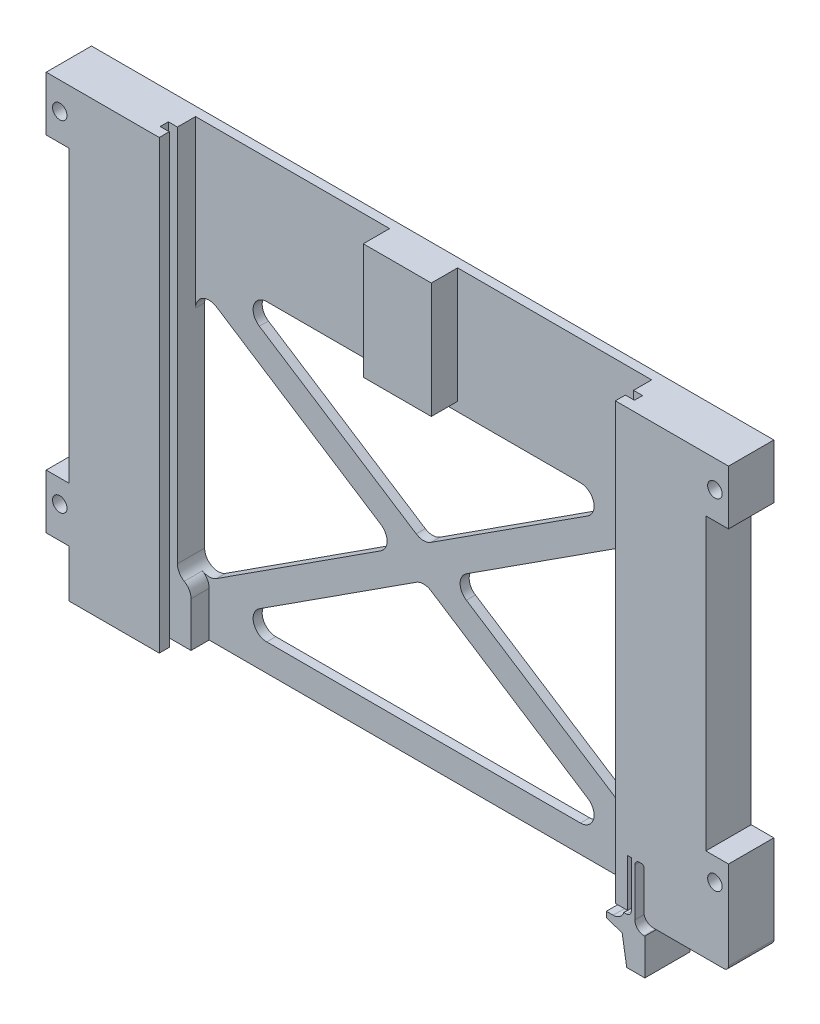
from build123d import *

# Parameters (mm, degrees)
SKETCH2_W           = 140.5
SKETCH2_H           = 98.5
BOSS_EXTRUDE6_DEPTH = 10
SKETCH10_W          = 100.6
SKETCH10_H          = 71
CUT_EXTRUDE4_DEPTH  = 172.8793181275746
CUT_EXTRUDE1_DEPTH  = 172.8793181275746
SKETCH5_W           = 100.6
SKETCH5_H           = 6
BOSS_EXTRUDE3_DEPTH = 2
CUT_EXTRUDE2_DEPTH  = 172.8793181275746
SKETCH4_4_R         = 1.5999999999999908
SKETCH4_4_R_2       = 1.599999999999993
SKETCH4_4_R_3       = 1.6000000000000039
SKETCH4_4_R_4       = 1.6000000000000003
BOSS_EXTRUDE7_DEPTH = 10
FILLET1_R           = 3
SKETCH4_3_R         = 1.5999999999999908
SKETCH4_3_R_2       = 1.599999999999993
SKETCH4_3_R_3       = 1.6000000000000039
SKETCH4_3_R_4       = 1.6000000000000003
BOSS_EXTRUDE2_DEPTH = 10
SKETCH7_W           = 100.6
SKETCH7_H           = 27.5
CUT_EXTRUDE3_DEPTH  = 8
SKETCH8_W           = 15.000000000000007
SKETCH8_H           = 25.5
BOSS_EXTRUDE4_DEPTH = 5.8
BOSS_EXTRUDE5_DEPTH = 4
FILLET2_R           = 3


with BuildPart() as part:
    # Sketch2 → Boss-Extrude6 (new body)
    with BuildSketch(Plane.XY):
        with Locations((70.25, 49.25)):
            Rectangle(SKETCH2_W, SKETCH2_H)
    extrude(amount=BOSS_EXTRUDE6_DEPTH)

    # Sketch10 → Cut-Extrude4 (cut, through all)
    with BuildSketch(Plane(origin=(0, 0, 0), x_dir=(-1, 0, 0), z_dir=(0, 0, -1))):
        with Locations((-70.25000000000001, 35.5)):
            Rectangle(SKETCH10_W, SKETCH10_H)
    extrude(amount=-CUT_EXTRUDE4_DEPTH, mode=Mode.SUBTRACT)

    # Sketch3 → Cut-Extrude1 (cut, through all)
    with BuildSketch(Plane.XZ):
        Polygon((17.950000000000006, 7.800000000000001), (122.55000000000001, 7.800000000000013), (122.55000000000001, 6.000000000000013), (17.950000000000006, 6), align=None)
    extrude(amount=-CUT_EXTRUDE1_DEPTH, mode=Mode.SUBTRACT)

    # Sketch5 → Boss-Extrude3 (add)
    with BuildSketch(Plane.XY):
        with Locations((70.25000000000001, 3)):
            Rectangle(SKETCH5_W, SKETCH5_H)
        Polygon((21.57809178761083, 3.480214864097709), (122.17809178761084, 68.48021486409772), (118.92190821238917, 73.51978513590232), (18.321908212389175, 8.519785135902309), align=None)
        Polygon((18.32190821238918, 68.48021486409769), (118.92190821238916, 3.4802148640977055), (122.17809178761082, 8.519785135902305), (21.578091787610838, 73.5197851359023), align=None)
    extrude(amount=BOSS_EXTRUDE3_DEPTH)

    # Sketch4 → Cut-Extrude2 (cut, through all)
    with BuildSketch(Plane.XY):
        with BuildLine():
            ThreePointArc((120.05000000000001, 4.44e-15), (121.50773797371134, 0.46899039884100846), (122.41854385646542, 1.6999999999999988))
            Line((122.41854385646542, 1.7000000000000002), (123.05000000000001, 1.7000000000000002))
            ThreePointArc((123.05000000000001, 1.7000000000000028), (123.75710678118656, 1.99289321881345), (124.05000000000001, 2.7))
            Line((124.05000000000001, 2.7), (124.05000000000001, 12.999999999999996))
            Line((124.05000000000001, 12.999999999999998), (123.25000000000001, 12.999999999999998))
            Line((123.25000000000001, 12.999999999999998), (123.25000000000001, 2.5))
            Line((123.25000000000001, 2.5), (117.55, 2.5))
            Line((117.55, 2.5), (117.55, 0))
            Line((117.55, 0), (118.55, 0))
            Line((118.55, 0), (120.05000000000001, 0))
        make_face()
        with BuildLine():
            ThreePointArc((144.50000000000003, 2), (145.20710678118658, 2.2928932188134525), (145.50000000000006, 3))
            Line((145.50000000000006, 3), (145.50000000000003, -0.5000000000000178))
            Line((145.50000000000003, -0.5000000000000178), (127.05, -0.5000000000000178))
            Line((127.05, -0.5000000000000178), (126.85, -0.5000000000000178))
            ThreePointArc((126.85, -0.5000000000000178), (125.4357864376269, 0.08578643762688709), (124.85, 1.499999999999982))
            Line((124.85, 1.499999999999982), (124.85, 12))
            ThreePointArc((124.85, 12), (125.14289321881344, 12.707106781186548), (125.85, 12.999999999999998))
            Line((125.85, 12.999999999999998), (126.35, 13))
            ThreePointArc((126.35, 13), (126.70355339059327, 12.853553390593271), (126.85, 12.499999999999998))
            Line((126.85, 12.499999999999998), (126.85, 4))
            ThreePointArc((126.85, 4), (127.4357864376269, 2.585786437626905), (128.85, 2))
            Line((128.85, 2), (144.50000000000003, 2))
        make_face()
    extrude(amount=CUT_EXTRUDE2_DEPTH, mode=Mode.SUBTRACT)

    # Sketch4<4> → Boss-Extrude7 (add, through all)
    # profile 1 of 4: a face of its own
    with BuildSketch(Plane.XY):
        with BuildLine():
            Line((128.85, 2), (144.50000000000003, 2))
            ThreePointArc((144.50000000000003, 2), (145.20710678118658, 2.2928932188134525), (145.50000000000006, 3))
            Line((145.50000000000006, 3), (145.50000000000003, 22.5))
            Line((145.50000000000003, 22.5), (140.5, 22.500000000000004))
            Line((140.5, 22.500000000000004), (124.05000000000001, 22.5))
            Line((124.05000000000001, 22.5), (124.05000000000001, 12.999999999999998))
            Line((124.05000000000001, 12.999999999999998), (124.05000000000001, 2.7))
            ThreePointArc((124.05000000000001, 2.7), (123.75710678118656, 1.9928932188134527), (123.05000000000001, 1.7000000000000002))
            Line((123.05000000000001, 1.7000000000000002), (122.41854385646542, 1.7000000000000002))
            ThreePointArc((122.41854385646542, 1.7000000000000002), (121.50773797371134, 0.4689903988410107), (120.05000000000001, 0))
            Line((120.05000000000001, 0), (118.55, 0))
            Line((118.55, 0), (118.55, -1.2))
            Line((118.55, -1.2), (122.05, -2.409773966310486))
            Line((122.05, -2.409773966310486), (123.05, -8.50000000000002))
            Line((123.05, -8.50000000000002), (127.05, -8.500000000000018))
            Line((127.05, -8.500000000000018), (127.05, -0.5000000000000178))
            Line((127.05, -0.5000000000000178), (126.85, -0.5000000000000178))
            ThreePointArc((126.85, -0.5000000000000178), (125.4357864376269, 0.08578643762688709), (124.85, 1.499999999999982))
            Line((124.85, 1.499999999999982), (124.85, 12))
            ThreePointArc((124.85, 12), (125.14289321881344, 12.707106781186548), (125.85, 12.999999999999998))
            Line((125.85, 12.999999999999998), (126.35, 13))
            ThreePointArc((126.35, 13), (126.70355339059327, 12.853553390593271), (126.85, 12.499999999999998))
            Line((126.85, 12.499999999999998), (126.85, 4))
            ThreePointArc((126.85, 4), (127.4357864376269, 2.585786437626905), (128.85, 2))
        make_face()
        with Locations((142.50000000000003, 17.5)):
            Circle(SKETCH4_4_R, mode=Mode.SUBTRACT)
    # profile 2 of 4: a face of its own
    with BuildSketch(Plane.XY):
        Polygon((145.50000000000003, 98.5), (145.50000000000003, 86.50000000000001), (140.5, 86.50000000000003), (140.5, 98.5), align=None)
        with Locations((142.5, 92.5)):
            Circle(SKETCH4_4_R_2, mode=Mode.SUBTRACT)
    # profile 3 of 4: a face of its own
    with BuildSketch(Plane.XY):
        Polygon((0, 98.49999999999999), (0, 86.50000000000001), (-5.000000000000004, 86.5), (-5.000000000000004, 98.49999999999999), align=None)
        with Locations((-1.9999999999999913, 92.5)):
            Circle(SKETCH4_4_R_3, mode=Mode.SUBTRACT)
    # profile 4 of 4: a face of its own
    with BuildSketch(Plane.XY):
        Polygon((8.67e-15, 22.499999999999986), (1.041e-14, 10.49999999999999), (-4.999999999999993, 10.499999999999986), (-4.999999999999996, 22.499999999999982), align=None)
        with Locations((-2.0000000000000018, 17.5)):
            Circle(SKETCH4_4_R_4, mode=Mode.SUBTRACT)
    extrude(amount=BOSS_EXTRUDE7_DEPTH)

    # Fillet1
    fillet1_edges = [part.edges().sort_by_distance(p)[0] for p in [
        (19.95000000000001, 67.42826688999527, 1),
        (19.949999999999992, 9.571733110004725, 1),
        (25.4779438594842, 71.00000000000001, 1),
        (115.02205614051576, 71, 1),
        (120.55000000000001, 9.571733110004711, 1),
        (120.55000000000003, 67.42826688999531, 1),
        (75.77794385948422, 38.50000000000003, 1),
        (70.24999999999997, 42.07173311000473, 1),
        (64.72205614051575, 38.499999999999986, 1),
        (25.477943859484185, 6.000000000000001, 1),
        (70.25, 34.928266889995285, 1),
        (115.0220561405158, 5.999999999999968, 1),
    ]]
    fillet(fillet1_edges, radius=FILLET1_R)

    # Sketch4<3> → Boss-Extrude2 (add, through all)
    # profile 1 of 4: a face of its own
    with BuildSketch(Plane.XY):
        with BuildLine():
            Line((123.05000000000001, 1.7000000000000002), (122.41854385646542, 1.7000000000000002))
            ThreePointArc((122.41854385646542, 1.6999999999999988), (121.50773797371134, 0.46899039884100846), (120.05000000000001, 4.44e-15))
            Line((120.05000000000001, 0), (118.55, 0))
            Line((118.55, 0), (118.55, -1.2))
            Line((118.55, -1.2), (122.05, -2.409773966310486))
            Line((122.05, -2.4097739663104853), (123.05, -8.50000000000002))
            Line((123.05, -8.50000000000002), (127.05, -8.500000000000018))
            Line((127.05, -8.500000000000018), (127.05, -0.5000000000000178))
            Line((127.05, -0.5000000000000178), (126.85, -0.5000000000000178))
            ThreePointArc((126.85, -0.5000000000000151), (125.4357864376269, 0.08578643762688865), (124.85, 1.499999999999982))
            Line((124.85, 1.4999999999999822), (124.85, 12))
            ThreePointArc((124.85, 12), (125.14289321881344, 12.70710678118655), (125.85, 12.999999999999996))
            Line((125.85, 12.999999999999998), (126.35, 13))
            ThreePointArc((126.35, 13), (126.70355339059327, 12.853553390593273), (126.85, 12.499999999999998))
            Line((126.85, 12.499999999999998), (126.85, 4))
            ThreePointArc((126.85, 4), (127.4357864376269, 2.585786437626907), (128.85, 2.000000000000003))
            Line((128.85, 2), (144.50000000000003, 2))
            ThreePointArc((144.50000000000003, 2.000000000000009), (145.20710678118658, 2.292893218813456), (145.50000000000006, 3))
            Line((145.50000000000006, 3), (145.50000000000003, 22.5))
            Line((145.50000000000003, 22.5), (140.5, 22.500000000000004))
            Line((140.5, 22.500000000000004), (124.05000000000001, 22.5))
            Line((124.05000000000001, 22.5), (124.05000000000001, 12.999999999999998))
            Line((124.05000000000001, 12.999999999999996), (124.05000000000001, 2.7))
            ThreePointArc((124.05000000000001, 2.7), (123.75710678118656, 1.99289321881345), (123.05000000000001, 1.7000000000000028))
        make_face()
        with Locations((142.50000000000003, 17.5)):
            Circle(SKETCH4_3_R, mode=Mode.SUBTRACT)
    # profile 2 of 4: a face of its own
    with BuildSketch(Plane.XY):
        Polygon((145.50000000000003, 98.5), (145.50000000000003, 86.50000000000001), (140.5, 86.50000000000003), (140.5, 98.5), align=None)
        with Locations((142.5, 92.5)):
            Circle(SKETCH4_3_R_2, mode=Mode.SUBTRACT)
    # profile 3 of 4: a face of its own
    with BuildSketch(Plane.XY):
        Polygon((0, 98.49999999999999), (0, 86.50000000000001), (-5.000000000000004, 86.5), (-5.000000000000004, 98.49999999999999), align=None)
        with Locations((-1.9999999999999913, 92.5)):
            Circle(SKETCH4_3_R_3, mode=Mode.SUBTRACT)
    # profile 4 of 4: a face of its own
    with BuildSketch(Plane.XY):
        Polygon((8.67e-15, 22.499999999999986), (1.041e-14, 10.49999999999999), (-4.999999999999993, 10.499999999999986), (-4.999999999999996, 22.499999999999982), align=None)
        with Locations((-2.0000000000000018, 17.5)):
            Circle(SKETCH4_3_R_4, mode=Mode.SUBTRACT)
    extrude(amount=BOSS_EXTRUDE2_DEPTH)

    # Sketch7 → Cut-Extrude3 (cut)
    with BuildSketch(Plane.XY.offset(10)):
        with Locations((70.25000000000001, 84.75)):
            Rectangle(SKETCH7_W, SKETCH7_H)
    extrude(amount=-CUT_EXTRUDE3_DEPTH, mode=Mode.SUBTRACT)

    # Sketch8 → Boss-Extrude4 (add)
    with BuildSketch(Plane.XY.offset(2)):
        with Locations((70.25000000000001, 85.75)):
            Rectangle(SKETCH8_W, SKETCH8_H)
    extrude(amount=BOSS_EXTRUDE4_DEPTH)

    # Sketch9 → Boss-Extrude5 (add)
    with BuildSketch(Plane.XY.offset(2)):
        with BuildLine():
            ThreePointArc((120.55000000000001, 15.081836001321573), (119.67132034355964, 12.960515657761938), (117.55000000000001, 12.081836001321571))
            Line((117.55000000000001, 12.081836001321573), (117.55000000000001, 2.5))
            Line((117.55000000000001, 2.5000000000000004), (120.55000000000001, 2.5))
            Line((120.55000000000001, 2.5), (120.55000000000001, 15.081836001321573))
        make_face()
        with BuildLine():
            Line((19.95000000000001, 15.081836001321587), (19.95000000000001, 0))
            Line((19.95000000000001, 0), (22.95000000000001, 0))
            Line((22.95000000000001, 0), (22.95000000000001, 12.08183600132159))
            ThreePointArc((22.95000000000001, 12.081836001321593), (20.828679656440368, 12.960515657761945), (19.95000000000001, 15.081836001321587))
        make_face()
    extrude(amount=BOSS_EXTRUDE5_DEPTH)

    # Fillet2
    fillet2_edges = [part.edges().sort_by_distance(p)[0] for p in [
        (22.95000000000001, 12.08183600132159, 4),
        (117.55000000000001, 12.08183600132157, 4),
    ]]
    fillet(fillet2_edges, radius=FILLET2_R)


solid = part.part
